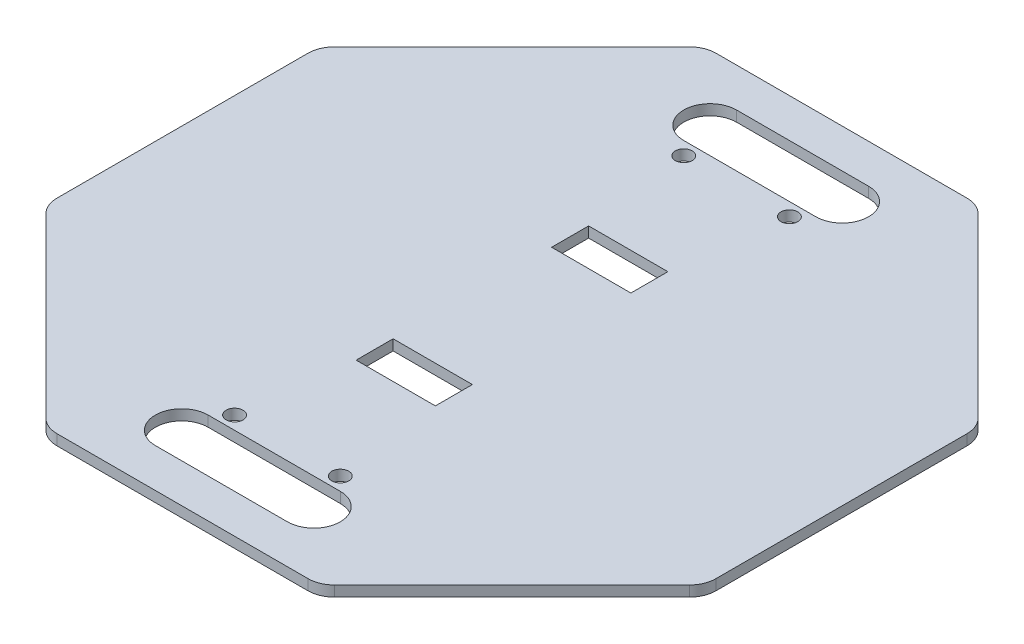
from build123d import *

# Parameters (mm, degrees)
SKETCH1_R           = 1.6
SKETCH1_W           = 15
SKETCH1_H           = 7
BOSS_EXTRUDE1_DEPTH = 2
FILLET1_R           = 5


with BuildPart() as part:
    # Sketch1 → Boss-Extrude1 (new body)
    with BuildSketch(Plane(origin=(0, 0, 0), x_dir=(1, 0, 0), z_dir=(0, 1, 0))):
        Polygon((62.361868445, 25.831131685), (62.361868445, -25.831131685), (25.831131685, -62.361868445), (-25.831131685, -62.361868445), (-62.361868445, -25.831131685), (-62.361868445, 25.831131685), (-25.831131685, 62.361868445), (25.831131685, 62.361868445), align=None)
        with Locations(Location((10, -42.5, 0), (0, 0, 270))):
            Circle(SKETCH1_R, mode=Mode.SUBTRACT)
        with Locations(Location((-10, -42.5, 0), (0, 0, 270))):
            Circle(SKETCH1_R, mode=Mode.SUBTRACT)
        with Locations(Location((-10, 42.5, 0), (0, 0, 270))):
            Circle(SKETCH1_R, mode=Mode.SUBTRACT)
        with Locations(Location((10, 42.5, 0), (0, 0, 270))):
            Circle(SKETCH1_R, mode=Mode.SUBTRACT)
        with BuildLine():
            Line((12.5, -55), (-12.5, -55))
            ThreePointArc((-12.5, -55), (-17.5, -50), (-12.5, -45))
            Line((-12.5, -45), (12.5, -45))
            ThreePointArc((12.5, -45), (17.5, -50), (12.5, -55))
        make_face(mode=Mode.SUBTRACT)
        with BuildLine():
            Line((12.5, 55), (-12.5, 55))
            ThreePointArc((-12.5, 55), (-17.5, 50), (-12.5, 45))
            Line((-12.5, 45), (12.5, 45))
            ThreePointArc((12.5, 45), (17.5, 50), (12.5, 55))
        make_face(mode=Mode.SUBTRACT)
        with Locations((0, -18.5)):
            Rectangle(SKETCH1_W, SKETCH1_H, mode=Mode.SUBTRACT)
        with Locations((0, 18.5)):
            Rectangle(SKETCH1_W, SKETCH1_H, mode=Mode.SUBTRACT)
    extrude(amount=BOSS_EXTRUDE1_DEPTH)

    # Fillet1
    fillet1_edges = [part.edges().sort_by_distance(p)[0] for p in [
        (-62.361868445, 1, -25.831131685),
        (-25.831131685, 1, -62.361868445),
        (25.831131685, 1, -62.361868445),
        (62.361868445, 1, -25.831131685),
        (62.361868445, 1, 25.831131685),
        (25.831131685, 1, 62.361868445),
        (-25.831131685, 1, 62.361868445),
        (-62.361868445, 1, 25.831131685),
    ]]
    fillet(fillet1_edges, radius=FILLET1_R)


solid = part.part
